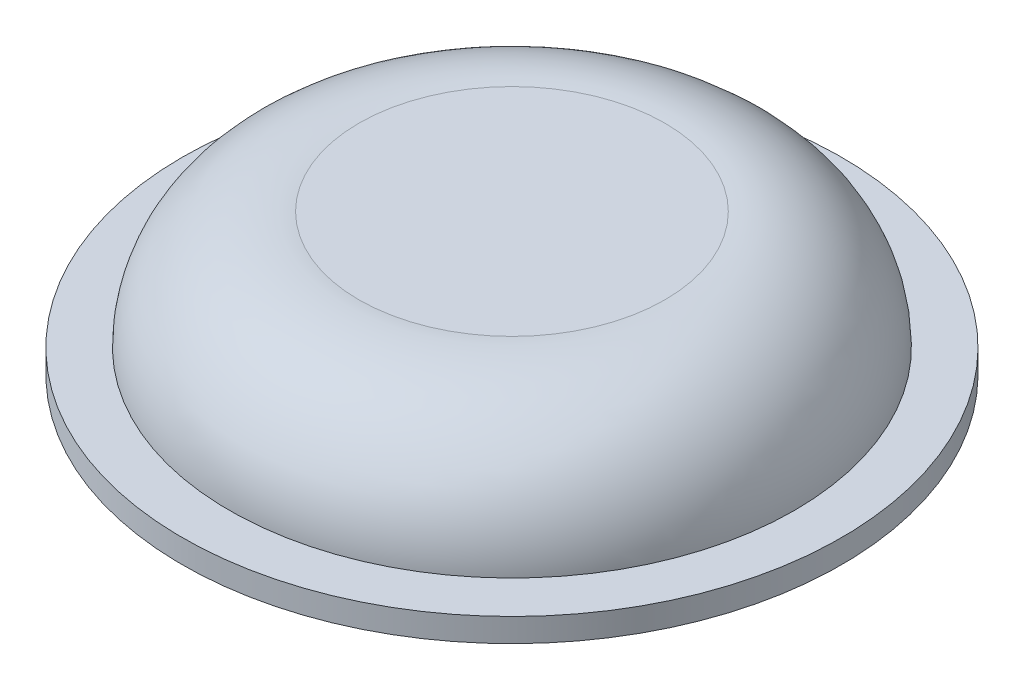
from build123d import *


with BuildPart() as part:
    # Sketch1 → Revolve1 (revolve)
    with BuildSketch(Plane.XY):
        with BuildLine():
            Line((-35.56, 0), (-35.56, 2.54))
            Line((-35.56, 2.54), (-30.48, 2.54))
            ThreePointArc((-30.48, 2.54), (-26.304048777, 11.979953655), (-16.51, 15.24))
            Line((-16.51, 15.24), (0, 15.24))
            Line((0, 15.24), (0, 6.427550656))
            Line((0, 6.427550656), (-2.54, 6.427550656))
            Line((-2.54, 6.427550656), (-2.54, 11.43))
            Line((-2.54, 11.43), (-22.759122002, 11.43))
            ThreePointArc((-22.759122002, 11.43), (-24.989007002, 9.723072017), (-26.67, 7.473571452))
            Line((-26.67, 7.473571452), (-26.67, 0))
            Line((-26.67, 0), (-35.56, 0))
        make_face()
    revolve(axis=Axis((0, 15.24, 0), (0, -1, 0)))


solid = part.part
